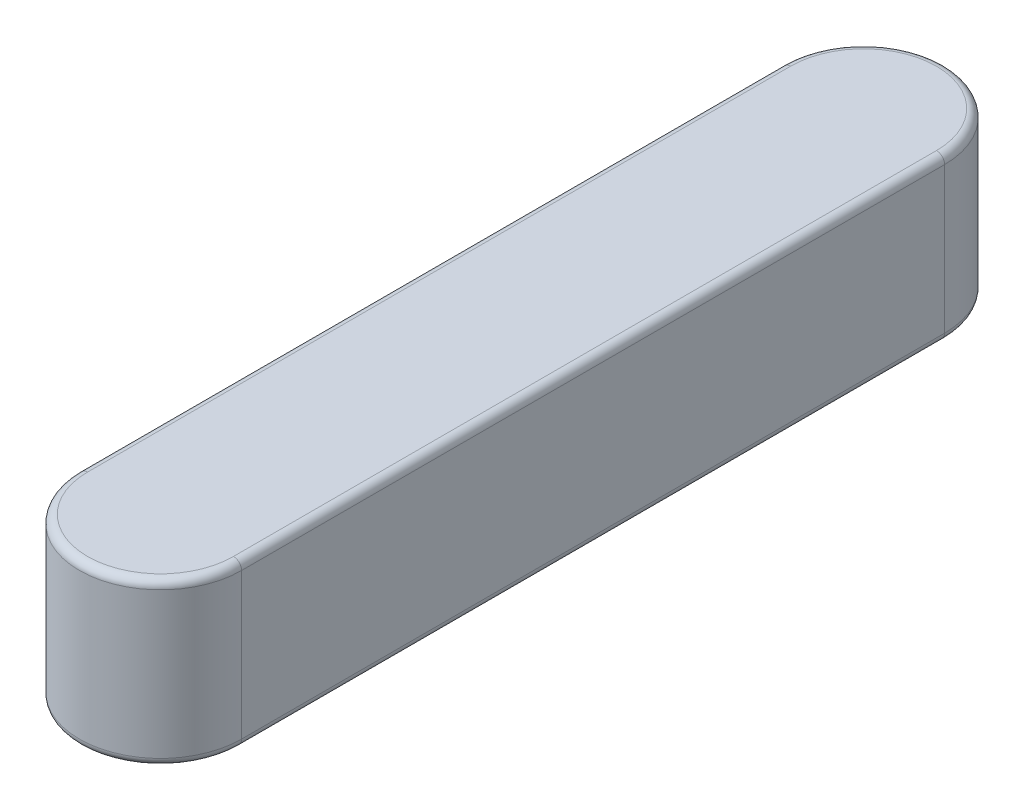
from build123d import *

# Parameters (mm, degrees)
BOSS_EXTRUDE1_START = 2.38125
BOSS_EXTRUDE1_DEPTH = 4.7625
FILLET1_R           = 0.238125


with BuildPart() as part:
    # Sketch4 → Boss-Extrude1 (new body)
    with BuildSketch(Plane(origin=(0, 0, 0), x_dir=(1, 0, 0), z_dir=(0, 1, 0)).offset(BOSS_EXTRUDE1_START)):
        with BuildLine():
            Line((-2.38125, 10.31875), (-2.38125, -10.31875))
            ThreePointArc((-2.38125, -10.31875), (0, -12.7), (2.38125, -10.31875))
            Line((2.38125, -10.31875), (2.38125, 10.31875))
            ThreePointArc((2.38125, 10.31875), (0, 12.7), (-2.38125, 10.31875))
        make_face()
    extrude(amount=-BOSS_EXTRUDE1_DEPTH)

    # Fillet1
    fillet1_edges = [part.edges().sort_by_distance(p)[0] for p in [
        (0, -2.38125, 12.7),
        (2.38125, -2.38125, 0),
        (0, -2.38125, -12.7),
        (2.38125, 2.38125, 0),
        (0, 2.38125, 12.7),
        (-2.38125, 2.38125, 0),
        (0, 2.38125, -12.7),
        (-2.38125, -2.38125, 0),
    ]]
    fillet(fillet1_edges, radius=FILLET1_R)


solid = part.part
